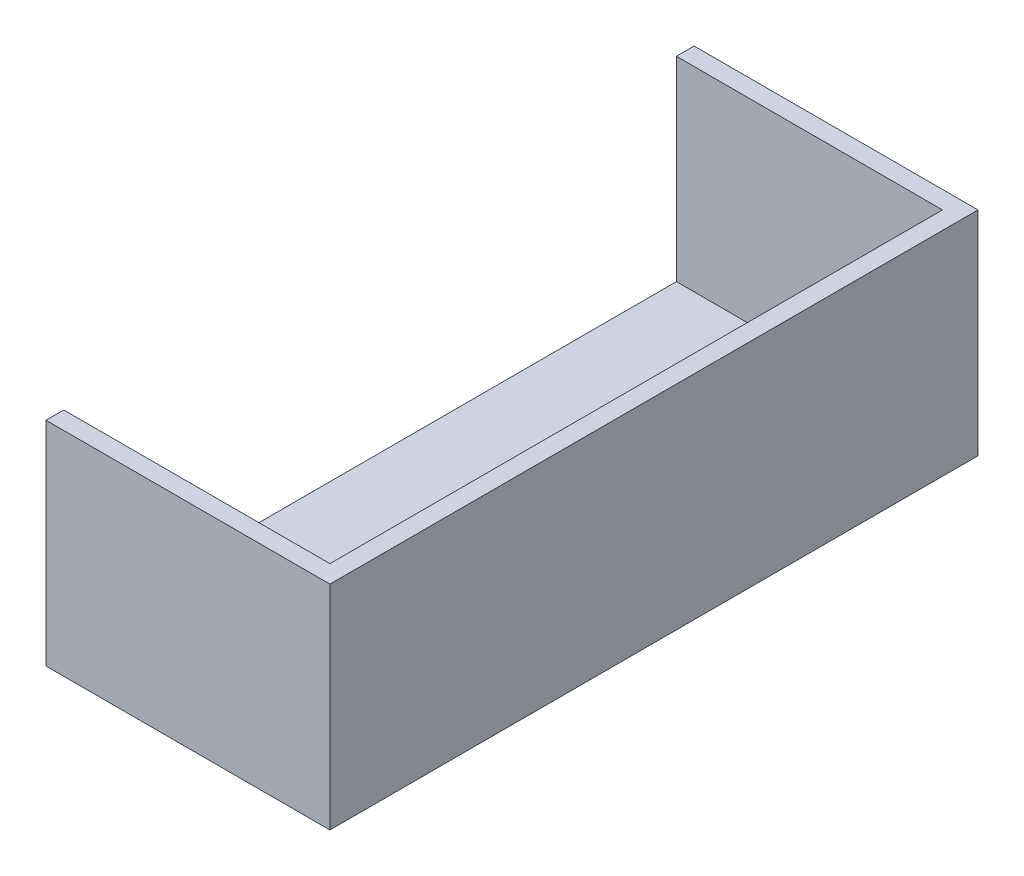
from build123d import *

# Parameters (mm, degrees)
SKETCH1_W               = 25.4
SKETCH1_H               = 19.05
BOSS_EXTRUDE2_DEPTH     = 57.9882
CUT_EXTRUDE3_DEPTH      = 65.019660763
CUT_EXTRUDE3_DEPTH_BACK = 23.8125
SKETCH4_W               = 54.8132
SKETCH4_H               = 17.4625
SKETCH5_R               = 4.0767
CUT_EXTRUDE4_DEPTH      = 23.8125


with BuildPart() as part:
    # Sketch1 → Boss-Extrude2 (new body)
    with BuildSketch(Plane.XY):
        Rectangle(SKETCH1_W, SKETCH1_H)
    extrude(amount=BOSS_EXTRUDE2_DEPTH)

    # Sketch4 → Cut-Extrude3 (cut, two sides: drawn at the far end of the back side and taken through both)
    with BuildSketch(Plane.ZY.offset(12.7).offset(-CUT_EXTRUDE3_DEPTH_BACK)):
        with Locations((28.9941, 0.79375)):
            Rectangle(SKETCH4_W, SKETCH4_H)
    extrude(amount=CUT_EXTRUDE3_DEPTH + CUT_EXTRUDE3_DEPTH_BACK, mode=Mode.SUBTRACT)

    # Sketch5 → Cut-Extrude4 (cut)
    with BuildSketch(Plane(origin=(0, -7.9375, 0), x_dir=(1, 0, 0), z_dir=(0, 1, 0))):
        with Locations(Location((0, -10.054166667, 0), (0, 0, 180))):
            Circle(SKETCH5_R)
        with Locations(Location((0, -49.521533333, 0), (0, 0, 180))):
            Circle(SKETCH5_R)
    extrude(amount=-CUT_EXTRUDE4_DEPTH, mode=Mode.SUBTRACT)


solid = part.part
